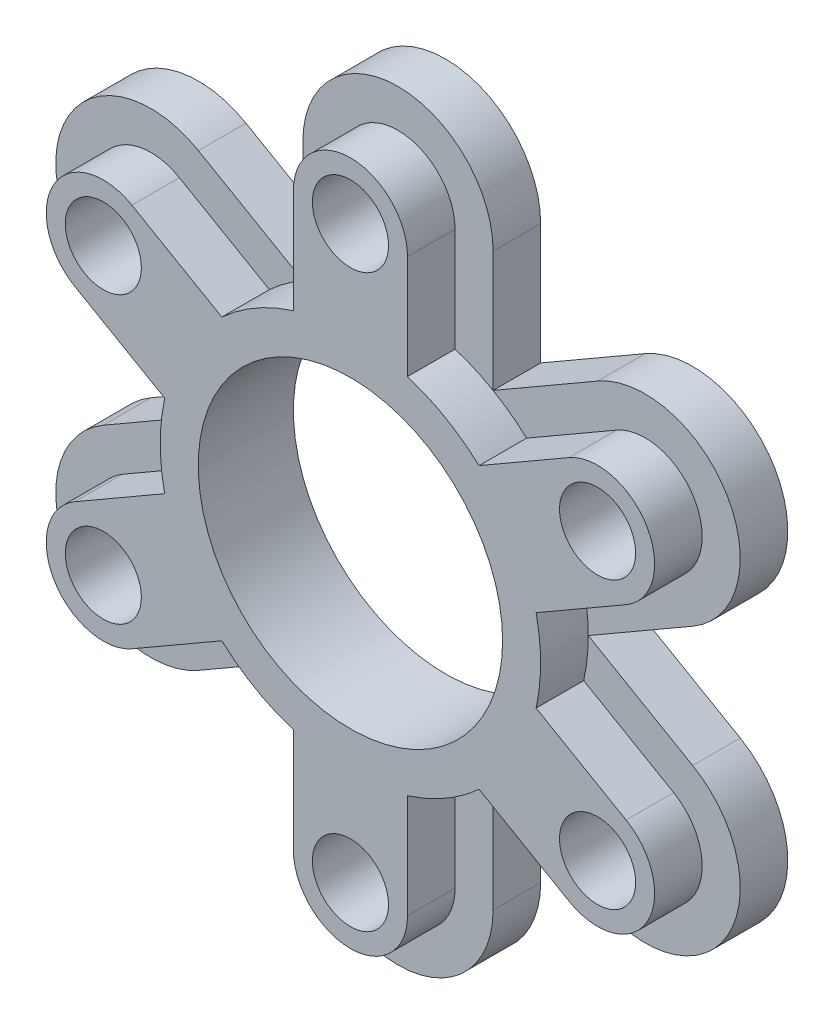
from build123d import *

# Parameters (mm, degrees)
SKETCH2_R           = 16
SKETCH2_R_2         = 4
BOSS_EXTRUDE6_DEPTH = 5
SKETCH3_R           = 4
SKETCH3_R_2         = 16
BOSS_EXTRUDE7_DEPTH = 5


with BuildPart() as part:
    # Sketch2 → Boss-Extrude6 (new body)
    with BuildSketch(Plane.XY):
        with BuildLine():
            Line((10, 30), (10, 17.320508076))
            Line((10, 17.320508076), (20.980762114, 23.660254038))
            ThreePointArc((20.980762114, 23.660254038), (34.641016151, 20), (30.980762114, 6.339745962))
            Line((30.980762114, 6.339745962), (20, 0))
            Line((20, 0), (30.980762114, -6.339745962))
            ThreePointArc((30.980762114, -6.339745962), (34.641016151, -20), (20.980762114, -23.660254038))
            Line((20.980762114, -23.660254038), (10, -17.320508076))
            Line((10, -17.320508076), (10, -30))
            ThreePointArc((10, -30), (0, -40), (-10, -30))
            Line((-10, -30), (-10, -17.320508076))
            Line((-10, -17.320508076), (-20.980762114, -23.660254038))
            ThreePointArc((-20.980762114, -23.660254038), (-34.641016151, -20), (-30.980762114, -6.339745962))
            Line((-30.980762114, -6.339745962), (-20, 0))
            Line((-20, 0), (-30.980762114, 6.339745962))
            ThreePointArc((-30.980762114, 6.339745962), (-34.641016151, 20), (-20.980762114, 23.660254038))
            Line((-20.980762114, 23.660254038), (-10, 17.320508076))
            Line((-10, 17.320508076), (-10, 30))
            ThreePointArc((-10, 30), (0, 40), (10, 30))
        make_face()
        Circle(SKETCH2_R, mode=Mode.SUBTRACT)
        with Locations((0, 30)):
            Circle(SKETCH2_R_2, mode=Mode.SUBTRACT)
        with Locations((25.980762114, 15)):
            Circle(SKETCH2_R_2, mode=Mode.SUBTRACT)
        with Locations((25.980762114, -15)):
            Circle(SKETCH2_R_2, mode=Mode.SUBTRACT)
        with Locations((0, -30)):
            Circle(SKETCH2_R_2, mode=Mode.SUBTRACT)
        with Locations((-25.980762114, -15)):
            Circle(SKETCH2_R_2, mode=Mode.SUBTRACT)
        with Locations((-25.980762114, 15)):
            Circle(SKETCH2_R_2, mode=Mode.SUBTRACT)
    extrude(amount=BOSS_EXTRUDE6_DEPTH)

    # Sketch3 → Boss-Extrude7 (add)
    with BuildSketch(Plane.XY.offset(5)):
        with BuildLine():
            Line((-6, 30), (-6, 19.078784028))
            ThreePointArc((-6, 19.078784028), (-10, 17.320508076), (-13.522711642, 14.735544437))
            Line((-13.522711642, 14.735544437), (-22.980762114, 20.196152423))
            ThreePointArc((-22.980762114, 20.196152423), (-31.176914536, 18), (-28.980762114, 9.803847577))
            Line((-28.980762114, 9.803847577), (-19.522711642, 4.343239591))
            ThreePointArc((-19.522711642, 4.343239591), (-20, 0), (-19.522711642, -4.343239591))
            Line((-19.522711642, -4.343239591), (-28.980762114, -9.803847577))
            ThreePointArc((-28.980762114, -9.803847577), (-31.176914536, -18), (-22.980762114, -20.196152423))
            Line((-22.980762114, -20.196152423), (-13.522711642, -14.735544437))
            ThreePointArc((-13.522711642, -14.735544437), (-10, -17.320508076), (-6, -19.078784028))
            Line((-6, -19.078784028), (-6, -30))
            ThreePointArc((-6, -30), (0, -36), (6, -30))
            Line((6, -30), (6, -19.078784028))
            ThreePointArc((6, -19.078784028), (10, -17.320508076), (13.522711642, -14.735544437))
            Line((13.522711642, -14.735544437), (22.980762114, -20.196152423))
            ThreePointArc((22.980762114, -20.196152423), (31.176914536, -18), (28.980762114, -9.803847577))
            Line((28.980762114, -9.803847577), (19.522711642, -4.343239591))
            ThreePointArc((19.522711642, -4.343239591), (20, 0), (19.522711642, 4.343239591))
            Line((19.522711642, 4.343239591), (28.980762114, 9.803847577))
            ThreePointArc((28.980762114, 9.803847577), (31.176914536, 18), (22.980762114, 20.196152423))
            Line((22.980762114, 20.196152423), (13.522711642, 14.735544437))
            ThreePointArc((13.522711642, 14.735544437), (10, 17.320508076), (6, 19.078784028))
            Line((6, 19.078784028), (6, 30))
            ThreePointArc((6, 30), (0, 36), (-6, 30))
        make_face()
        with Locations((0, 30)):
            Circle(SKETCH3_R, mode=Mode.SUBTRACT)
        with Locations((25.980762114, 15)):
            Circle(SKETCH3_R, mode=Mode.SUBTRACT)
        with Locations((25.980762114, -15)):
            Circle(SKETCH3_R, mode=Mode.SUBTRACT)
        with Locations((0, -30)):
            Circle(SKETCH3_R, mode=Mode.SUBTRACT)
        with Locations((-25.980762114, -15)):
            Circle(SKETCH3_R, mode=Mode.SUBTRACT)
        with Locations((-25.980762114, 15)):
            Circle(SKETCH3_R, mode=Mode.SUBTRACT)
        Circle(SKETCH3_R_2, mode=Mode.SUBTRACT)
    extrude(amount=BOSS_EXTRUDE7_DEPTH)


solid = part.part
